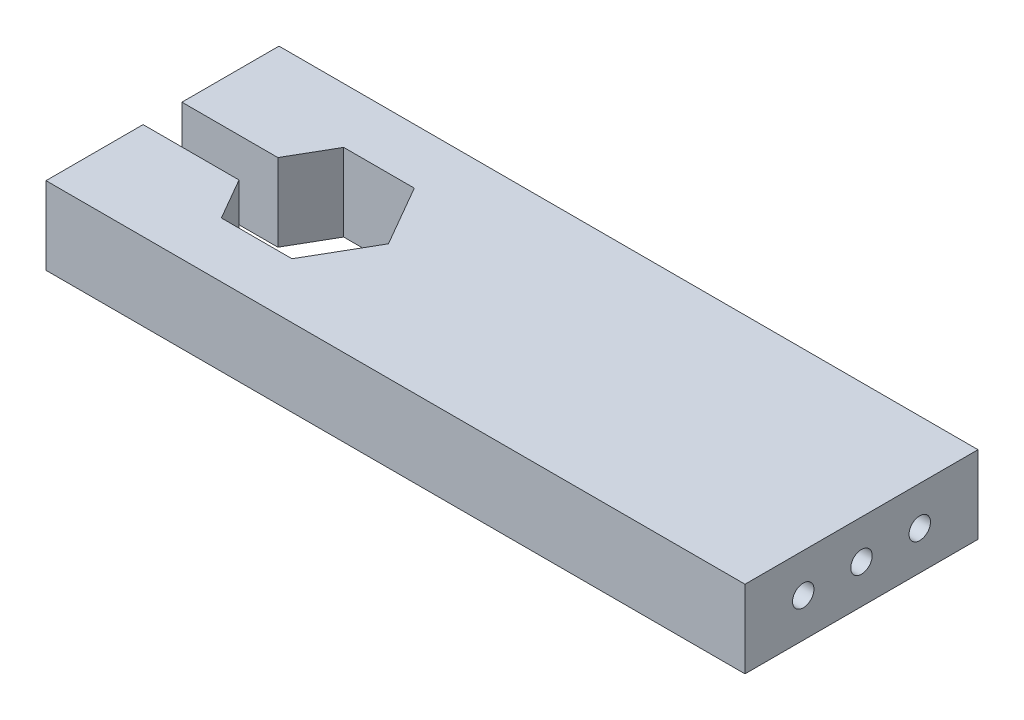
from build123d import *

# Parameters (mm, degrees)
SKETCH1_W                  = 114.3
SKETCH1_H                  = 38.1
BOSS_EXTRUDE1_DEPTH        = 6.35
F_6_32_THREADED_HOLE_D     = 3.5052
F_6_32_THREADED_HOLE_DEPTH = 50.8
F_6_32_THREADED_HOLE_TIP   = 1.053068321
CUT_EXTRUDE1_DEPTH         = 12.7
SKETCH8_W                  = 19.626497308
SKETCH8_H                  = 6.35
CUT_EXTRUDE2_DEPTH         = 117.570504417


with BuildPart() as part:
    # Sketch1 → Boss-Extrude1 (new, symmetric)
    with BuildSketch(Plane(origin=(0, 0, 0), x_dir=(1, 0, 0), z_dir=(0, 1, 0))):
        with Locations((-57.15, 0)):
            Rectangle(SKETCH1_W, SKETCH1_H)
    extrude(amount=BOSS_EXTRUDE1_DEPTH, both=True)

    # #6-32 Threaded Hole
    with Locations(Plane(origin=(0, 0, 0), x_dir=(0, 0, -1), z_dir=(1, 0, 0))):
        with Locations((0, 0), (9.525, 0), (-9.525, 0)):
            Hole(F_6_32_THREADED_HOLE_D / 2, depth=F_6_32_THREADED_HOLE_DEPTH)
            with Locations((0, 0, -(F_6_32_THREADED_HOLE_DEPTH + F_6_32_THREADED_HOLE_TIP / 2))):  # 118° drill point
                Cone(0, F_6_32_THREADED_HOLE_D / 2, F_6_32_THREADED_HOLE_TIP, mode=Mode.SUBTRACT)

    # Sketch5 → Cut-Extrude1 (cut)
    with BuildSketch(Plane(origin=(0, 6.35, 0), x_dir=(1, 0, 0), z_dir=(0, 1, 0))):
        Polygon((-83.126497308, -10), (-77.352994616, 0), (-83.126497308, 10), (-94.673502692, 10), (-100.447005384, 0), (-94.673502692, -10), align=None)
    extrude(amount=-CUT_EXTRUDE1_DEPTH, mode=Mode.SUBTRACT)

    # Sketch8 → Cut-Extrude2 (cut, through all)
    with BuildSketch(Plane(origin=(0, 6.35, 0), x_dir=(1, 0, 0), z_dir=(0, 1, 0))):
        with Locations((-104.486751346, 0)):
            Rectangle(SKETCH8_W, SKETCH8_H)
    extrude(amount=-CUT_EXTRUDE2_DEPTH, mode=Mode.SUBTRACT)


solid = part.part
